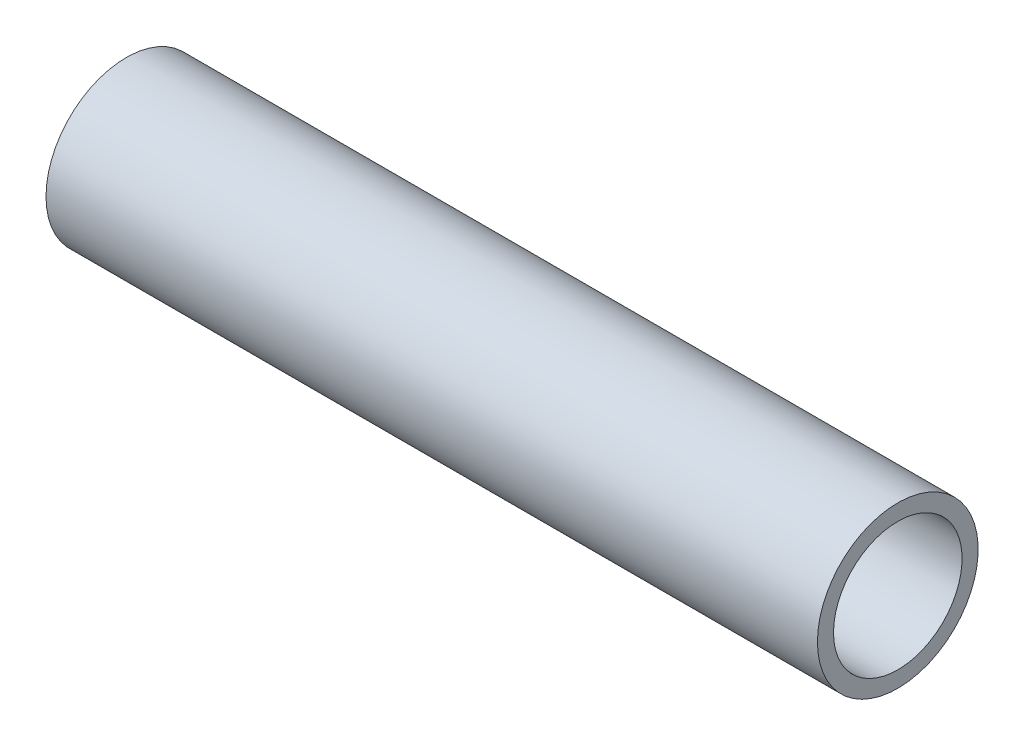
from build123d import *

# Parameters (mm, degrees)
SKETCH1_R           = 7.9375
SKETCH1_R_2         = 6.35
BOSS_EXTRUDE1_DEPTH = 38.1


with BuildPart() as part:
    # Sketch1 → Boss-Extrude1 (new, symmetric)
    with BuildSketch(Plane(origin=(0, 0, 0), x_dir=(0, 0, -1), z_dir=(1, 0, 0))):
        with Locations(Location((0, 0, 0), (0, 0, 180))):
            Circle(SKETCH1_R)
        with Locations(Location((0, 0, 0), (0, 0, 180))):
            Circle(SKETCH1_R_2, mode=Mode.SUBTRACT)
    extrude(amount=BOSS_EXTRUDE1_DEPTH, both=True)


solid = part.part
